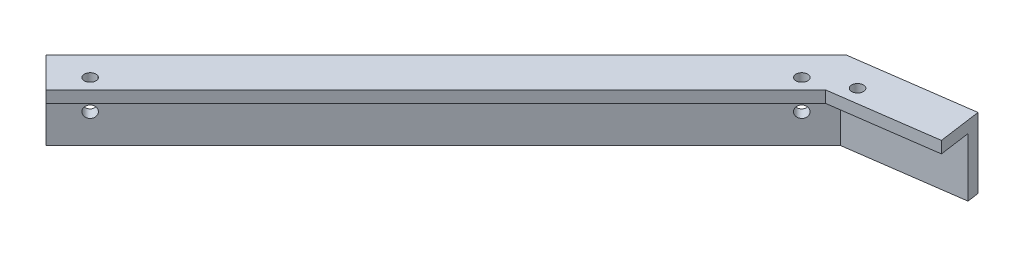
from build123d import *

# Parameters (mm, degrees)
CROQUIS1_R                = 1.5
SALIENTE_EXTRUIR2_DEPTH   = 3
SALIENTE_EXTRUIR2_2_DEPTH = 3
SALIENTE_EXTRUIR3_DEPTH   = 3
CROQUIS4_R                = 1.5
CORTAR_EXTRUIR2_DEPTH     = 3
SALIENTE_EXTRUIR4_START   = -3
CROQUIS5_R                = 1.5
SALIENTE_EXTRUIR4_DEPTH   = 3
SALIENTE_EXTRUIR5_DEPTH   = 15
CROQUIS7_R                = 1.5
CORTAR_EXTRUIR3_DEPTH     = 15
CROQUIS8_R                = 1.5
CORTAR_EXTRUIR4_DEPTH     = 15
CROQUIS9_R                = 1.5
CORTAR_EXTRUIR5_DEPTH     = 15
CROQUIS10_W               = 171.955680855
CROQUIS10_H               = 133.390966078
CORTAR_EXTRUIR7_DEPTH     = 20
SALIENTE_EXTRUIR6_DEPTH   = 3
CORTAR_EXTRUIR8_DEPTH     = 30
SALIENTE_EXTRUIR8_DEPTH   = 6
CROQUIS14_W               = 57.762581119
CROQUIS14_H               = 36.72323038
CORTAR_EXTRUIR9_DEPTH     = 3
CROQUIS15_W               = 30
CROQUIS15_H               = 23.44
CORTAR_EXTRUIR11_DEPTH    = 10
SALIENTE_EXTRUIR9_DEPTH   = 15
CROQUIS17_R               = 1.5
CORTAR_EXTRUIR12_DEPTH    = 15
SKETCH1_R                 = 1.5
CUT_EXTRUDE1_DEPTH        = 206.150827734


with BuildPart() as part:
    # Croquis1 → Saliente-Extruir2 (new body)
    with BuildSketch(Plane(origin=(0, 0, 0), x_dir=(1, 0, 0), z_dir=(0, 1, 0))):
        Polygon((35, 0), (65, 0), (167.530483272, -102.530483272), (161.873629023, -108.187337522), (61.686291501, -8), (35, -8), align=None)
        with Locations(Location((50, -4, 0), (0, 0, 270))):
            Circle(CROQUIS1_R, mode=Mode.SUBTRACT)
        with Locations(Location((159.045201898, -99.702056147, 0), (0, 0, 270))):
            Circle(CROQUIS1_R, mode=Mode.SUBTRACT)
        with Locations(Location((67.828427125, -8.485281374, 0), (0, 0, 270))):
            Circle(CROQUIS1_R, mode=Mode.SUBTRACT)
    extrude(amount=SALIENTE_EXTRUIR2_DEPTH)



with BuildPart() as body_2:
    # Croquis1 → Saliente-Extruir2 2 (new body)
    with BuildSketch(Plane(origin=(0, 0, 0), x_dir=(1, 0, 0), z_dir=(0, 1, 0))):
        Polygon((-35, 0), (-65, 0), (-167.530483272, -102.530483272), (-161.873629023, -108.187337522), (-61.686291501, -8), (-35, -8), align=None)
        with Locations(Location((-50, -4, 0), (0, 0, 270))):
            Circle(CROQUIS1_R, mode=Mode.SUBTRACT)
        with Locations(Location((-67.828427125, -8.485281374, 0), (0, 0, 270))):
            Circle(CROQUIS1_R, mode=Mode.SUBTRACT)
        with Locations(Location((-159.045201898, -99.702056147, 0), (0, 0, 270))):
            Circle(CROQUIS1_R, mode=Mode.SUBTRACT)
    extrude(amount=SALIENTE_EXTRUIR2_2_DEPTH)


with BuildPart() as part_1:
    add(part.part)

    add(body_2.part)  # Saliente-Extruir3 merges body 2
    # Croquis3 → Saliente-Extruir3 (add)
    with BuildSketch(Plane(origin=(0, 3, 0), x_dir=(1, 0, 0), z_dir=(0, 1, 0))):
        Polygon((-161.873629023, -108.187337522), (-159.752308679, -110.308657865), (-60.443650814, -11), (-35, -11), (-35, -8), (-61.686291501, -8), align=None)
        Polygon((35, -8), (61.686291501, -8), (161.873629023, -108.187337522), (159.752308679, -110.308657865), (60.443650814, -11), (35, -11), align=None)
    extrude(amount=-SALIENTE_EXTRUIR3_DEPTH)

    # Croquis4 → Cortar-Extruir2 (cut)
    with BuildSketch(Plane(origin=(0, 3, 0), x_dir=(1, 0, 0), z_dir=(0, 1, 0))):
        with Locations(Location((-50, -7.1, 0), (0, 0, 270))):
            Circle(CROQUIS4_R)
        with Locations(Location((-65.636396103, -10.677312396, 0), (0, 0, 270))):
            Circle(CROQUIS4_R)
        with Locations(Location((-156.853170876, -101.894087169, 0), (0, 0, 270))):
            Circle(CROQUIS4_R)
        with Locations(Location((50, -7.1, 0), (0, 0, 270))):
            Circle(CROQUIS4_R)
        with Locations(Location((65.636396103, -10.677312396, 0), (0, 0, 270))):
            Circle(CROQUIS4_R)
        with Locations(Location((156.853170876, -101.894087169, 0), (0, 0, 270))):
            Circle(CROQUIS4_R)
    extrude(amount=-CORTAR_EXTRUIR2_DEPTH, mode=Mode.SUBTRACT)

    # Croquis5 → Saliente-Extruir4 (add)
    with BuildSketch(Plane(origin=(0, 3, 0), x_dir=(1, 0, 0), z_dir=(0, 1, 0)).offset(SALIENTE_EXTRUIR4_START)):
        with Locations((-159.045201898, -99.702056147)):
            Circle(CROQUIS5_R)
        with Locations((-67.828427125, -8.485281374)):
            Circle(CROQUIS5_R)
        with Locations((-50, -4)):
            Circle(CROQUIS5_R)
        with Locations((50, -4)):
            Circle(CROQUIS5_R)
        with Locations((67.828427125, -8.485281374)):
            Circle(CROQUIS5_R)
        with Locations((159.045201898, -99.702056147)):
            Circle(CROQUIS5_R)
    extrude(amount=SALIENTE_EXTRUIR4_DEPTH)

    # Croquis6 → Saliente-Extruir5 (add)
    with BuildSketch(Plane(origin=(0, 0, 0), x_dir=(-1, 0, 0), z_dir=(0, -1, 0))):
        Polygon((167.530483272, -102.530483272), (65, 0), (35, 0), (35, -3), (63.757359313, -3), (165.409162928, -104.651803616), align=None)
        Polygon((-35, 0), (-35, -3), (-63.757359313, -3), (-165.409162928, -104.651803616), (-167.530483272, -102.530483272), (-65, 0), align=None)
    extrude(amount=SALIENTE_EXTRUIR5_DEPTH)

    # Croquis7 → Cortar-Extruir3 (cut)
    with BuildSketch(Plane(origin=(0, 0, 0), x_dir=(-1, 0, 0), z_dir=(0, 0, -1))):
        with Locations((50, -7.5)):
            Circle(CROQUIS7_R)
        with Locations((-50, -7.5)):
            Circle(CROQUIS7_R)
    extrude(amount=-CORTAR_EXTRUIR3_DEPTH, mode=Mode.SUBTRACT)

    # Croquis8 → Cortar-Extruir4 (cut)
    with BuildSketch(Plane(origin=(-32.5, 0, -32.5), x_dir=(-0.7071067811865476, 0, 0.7071067811865476), z_dir=(-0.7071067811865476, 0, -0.7071067811865476))):
        with Locations((182.961940777, -7.5)):
            Circle(CROQUIS8_R)
        with Locations((53.961940777, -7.5)):
            Circle(CROQUIS8_R)
    extrude(amount=-CORTAR_EXTRUIR4_DEPTH, mode=Mode.SUBTRACT)

    # Croquis9 → Cortar-Extruir5 (cut)
    with BuildSketch(Plane(origin=(32.5, 0, -32.5), x_dir=(-0.7071067811865476, 0, -0.7071067811865476), z_dir=(0.7071067811865476, 0, -0.7071067811865476))):
        with Locations((-182.961940777, -7.5)):
            Circle(CROQUIS9_R)
        with Locations((-53.961940777, -7.5)):
            Circle(CROQUIS9_R)
    extrude(amount=-CORTAR_EXTRUIR5_DEPTH, mode=Mode.SUBTRACT)

    # Croquis10 → Cortar-Extruir7 (cut)
    with BuildSketch(Plane(origin=(0, 3, 0), x_dir=(1, 0, 0), z_dir=(0, 1, 0))):
        with Locations((120.977840428, -66.695483039)):
            Rectangle(CROQUIS10_W, CROQUIS10_H)
    extrude(amount=-CORTAR_EXTRUIR7_DEPTH, mode=Mode.SUBTRACT)

    # Croquis11 → Saliente-Extruir6 (add)
    with BuildSketch(Plane(origin=(0, 3, 0), x_dir=(1, 0, 0), z_dir=(0, 1, 0))):
        Polygon((-65, 0), (-35.287813482, 4.145596742), (-33.767761344, -6.748871648), (-59.828674856, -10.385024042), (-60.443650814, -11), align=None)
    extrude(amount=SALIENTE_EXTRUIR6_DEPTH)

    # Croquis12 → Cortar-Extruir8 (cut)
    with BuildSketch(Plane(origin=(0, 3, 0), x_dir=(1, 0, 0), z_dir=(0, 1, 0))):
        Polygon((-60.443650814, -11), (-59.828674856, -10.385024042), (-33.767761344, -6.748871648), (-35, -11), align=None)
    extrude(amount=-CORTAR_EXTRUIR8_DEPTH, mode=Mode.SUBTRACT)

    # Croquis13 → Saliente-Extruir8 (add)
    with BuildSketch(Plane(origin=(0, 6, 0), x_dir=(1, 0, 0), z_dir=(0, 1, 0))):
        Polygon((-65, 0), (-60.443650814, -11), (-59.828674856, -10.385024042), (-33.767761344, -6.748871648), (-35.287813482, 4.145596742), align=None)
    extrude(amount=-SALIENTE_EXTRUIR8_DEPTH)

    # Croquis14 → Cortar-Extruir9 (cut)
    with BuildSketch(Plane(origin=(0, 6, 0), x_dir=(1, 0, 0), z_dir=(0, 1, 0))):
        with Locations((-50.851797543, 0.099312149)):
            Rectangle(CROQUIS14_W, CROQUIS14_H)
    extrude(amount=-CORTAR_EXTRUIR9_DEPTH, mode=Mode.SUBTRACT)

    # Croquis15 → Cortar-Extruir11 (cut)
    with BuildSketch(Plane(origin=(-1.241209114, 0, -8.895953705), x_dir=(-0.9904062172531611, 0, 0.13818655805209223), z_dir=(-0.13818655805209226, 0, -0.9904062172531612))):
        with Locations((49.376404121, -11.72)):
            Rectangle(CROQUIS15_W, CROQUIS15_H)
    extrude(amount=-CORTAR_EXTRUIR11_DEPTH, mode=Mode.SUBTRACT)

    # Croquis16 → Saliente-Extruir9 (add)
    with BuildSketch(Plane(origin=(0, 0, 0), x_dir=(-1, 0, 0), z_dir=(0, -1, 0))):
        Polygon((65, 0), (35.287813482, 4.145596742), (34.873253808, 1.17437809), (63.589638597, -2.832279284), (64.480524839, -3.723165526), align=None)
    extrude(amount=SALIENTE_EXTRUIR9_DEPTH)

    # Croquis17 → Cortar-Extruir12 (cut)
    with BuildSketch(Plane(origin=(0, 0, 0), x_dir=(-1, 0, 0), z_dir=(0, -1, 0))):
        with Locations(Location((56.0956257, -5.926391678, 0), (0, 0, 90))):
            Circle(CROQUIS17_R)
    extrude(amount=-CORTAR_EXTRUIR12_DEPTH, mode=Mode.SUBTRACT)

    # Sketch1 → Cut-Extrude1 (cut, through all)
    with BuildSketch(Plane(origin=(-1.241209114, 0, -8.895953705), x_dir=(-0.9904062172531611, 0, 0.13818655805209223), z_dir=(-0.13818655805209226, 0, -0.9904062172531612))):
        with Locations((56.376404121, -4.1)):
            Circle(SKETCH1_R)
    extrude(amount=-CUT_EXTRUDE1_DEPTH, mode=Mode.SUBTRACT)


solid = part_1.part
